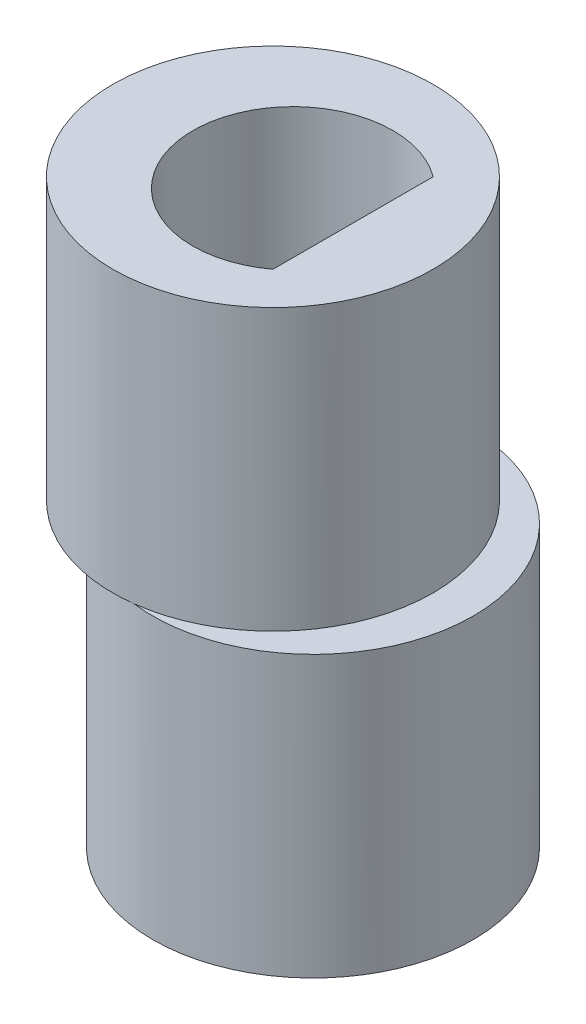
from build123d import *

# Parameters (mm, degrees)
SKETCH1_R           = 4
SKETCH1_R_2         = 2.5
BOSS_EXTRUDE1_DEPTH = 7
SKETCH2_R           = 4
SKETCH2_R_2         = 2.5
BOSS_EXTRUDE2_DEPTH = 7
BOSS_EXTRUDE3_DEPTH = 14


with BuildPart() as part:
    # Sketch1 → Boss-Extrude1 (new body)
    with BuildSketch(Plane(origin=(0, 0, 0), x_dir=(1, 0, 0), z_dir=(0, 1, 0))):
        with Locations(Location((0.5, 0, 0), (0, 0, 270))):
            Circle(SKETCH1_R)
        with Locations(Location((0, 0, 0), (0, 0, 270))):
            Circle(SKETCH1_R_2, mode=Mode.SUBTRACT)
    extrude(amount=BOSS_EXTRUDE1_DEPTH)

    # Sketch2 → Boss-Extrude2 (add)
    with BuildSketch(Plane(origin=(0, 7, 0), x_dir=(1, 0, 0), z_dir=(0, 1, 0))):
        with Locations(Location((-0.5, 0, 0), (0, 0, 82.819244219))):
            Circle(SKETCH2_R)
        with Locations(Location((0, 0, 0), (0, 0, 270))):
            Circle(SKETCH2_R_2, mode=Mode.SUBTRACT)
    extrude(amount=BOSS_EXTRUDE2_DEPTH)

    # Sketch3 → Boss-Extrude3 (add, through all)
    with BuildSketch(Plane(origin=(0, 14, 0), x_dir=(1, 0, 0), z_dir=(0, 1, 0))):
        with BuildLine():
            Line((1.5, 2), (1.5, -2))
            ThreePointArc((1.5, -2), (2.5, 0), (1.5, 2))
        make_face()
    extrude(amount=-BOSS_EXTRUDE3_DEPTH)


solid = part.part
